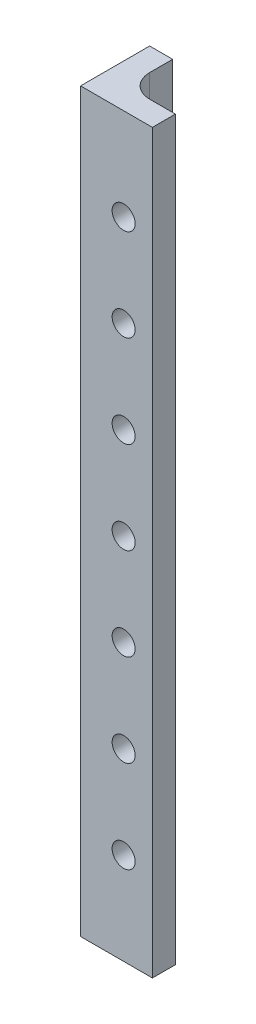
from build123d import *

# Parameters (mm, degrees)
BOSS_EXTRUDE1_DEPTH = 203.2
FILLET1_R           = 6.35
SKETCH2_R           = 3.175
CUT_EXTRUDE1_DEPTH  = 206.050378795
LPATTERN1_COUNT     = 7
LPATTERN1_PITCH     = 25.4


with BuildPart() as part:
    # Sketch1 → Boss-Extrude1 (new body)
    with BuildSketch(Plane(origin=(0, 0, 0), x_dir=(1, 0, 0), z_dir=(0, 1, 0))):
        Polygon((0, 0), (0, 19.05), (6.35, 19.05), (6.35, 6.35), (19.812, 6.35), (19.812, 0), align=None)
    extrude(amount=-BOSS_EXTRUDE1_DEPTH)

    # Fillet1
    fillet1_edges = [part.edges().sort_by_distance(p)[0] for p in [
        (6.35, -101.6, -6.35),
    ]]
    fillet(fillet1_edges, radius=FILLET1_R)

    # Sketch2 → Cut-Extrude1 (cut, through all)
    with BuildSketch(Plane.XY):
        with Locations((11.8745, -25.4)):
            Circle(SKETCH2_R)
    cut_extrude1 = extrude(amount=-CUT_EXTRUDE1_DEPTH, mode=Mode.SUBTRACT)

    # LPattern1: Cut-Extrude1 ×7
    with Locations(*[(0, -i * LPATTERN1_PITCH, 0) for i in range(1, LPATTERN1_COUNT)]):
        add(cut_extrude1, mode=Mode.SUBTRACT)


solid = part.part
